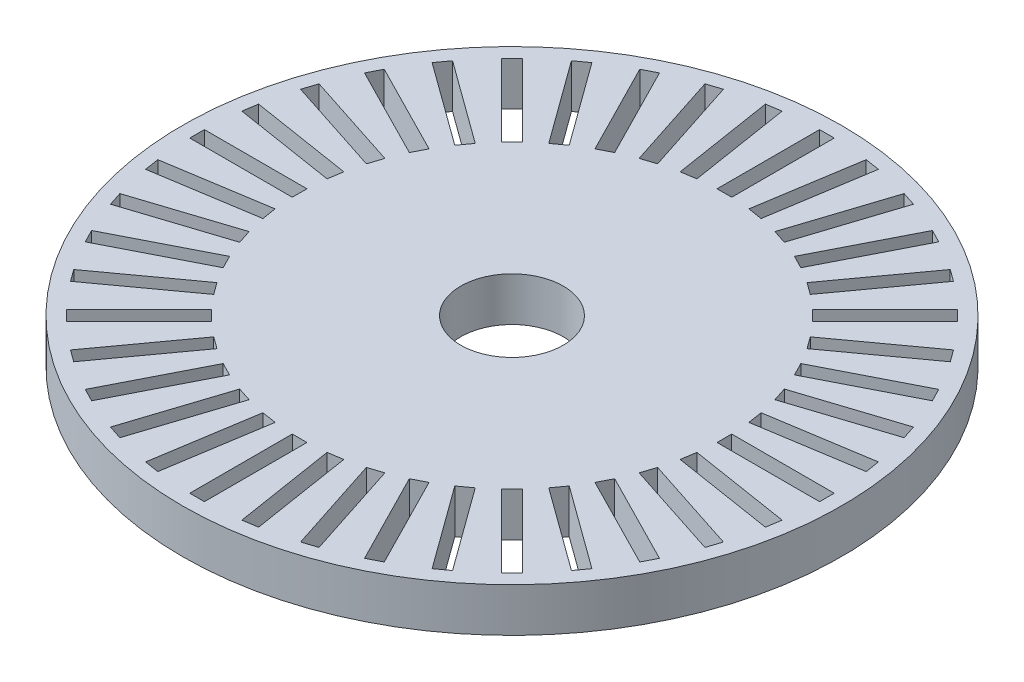
from build123d import *

# Parameters (mm, degrees)
CROQUIS1_R              = 22.5
CROQUIS1_R_2            = 3.5
CROQUIS1_W              = 1
CROQUIS1_H              = 7
CROQUIS1_W_2            = 7
CROQUIS1_H_2            = 1
SALIENTE_EXTRUIR1_DEPTH = 3


with BuildPart() as part:
    # Croquis1 → Saliente-Extruir1 (new body)
    with BuildSketch(Plane(origin=(0, 0, 0), x_dir=(1, 0, 0), z_dir=(0, 1, 0))):
        with Locations(Location((0, 0, 0), (0, 0, 270))):
            Circle(CROQUIS1_R)
        with Locations(Location((0, 0, 0), (0, 0, 270))):
            Circle(CROQUIS1_R_2, mode=Mode.SUBTRACT)
        with Locations((0, 18)):
            Rectangle(CROQUIS1_W, CROQUIS1_H, mode=Mode.SUBTRACT)
        Polygon((2.869496828, 21.313516555), (3.857185169, 21.15708209), (2.762143913, 14.243263706), (1.774455573, 14.399698171), align=None, mode=Mode.SUBTRACT)
        Polygon((6.168337121, 20.602223598), (7.119393637, 20.293206603), (4.956274677, 13.635810989), (4.00521816, 13.944827983), align=None, mode=Mode.SUBTRACT)
        Polygon((9.315292482, 19.38363552), (10.206299006, 18.92964502), (7.028365508, 12.692599351), (6.137358984, 13.146589851), align=None, mode=Mode.SUBTRACT)
        Polygon((12.232874427, 17.687758005), (13.041891421, 17.099972753), (8.927394655, 11.436853792), (8.118377661, 12.024639045), align=None, mode=Mode.SUBTRACT)
        Polygon((14.849242405, 15.556349186), (15.556349186, 14.849242405), (10.606601718, 9.899494937), (9.899494937, 10.606601718), align=None, mode=Mode.SUBTRACT)
        Polygon((17.099972753, 13.041891421), (17.687758005, 12.232874427), (12.024639045, 8.118377661), (11.436853792, 8.927394655), align=None, mode=Mode.SUBTRACT)
        Polygon((18.92964502, 10.206299006), (19.38363552, 9.315292482), (13.146589851, 6.137358984), (12.692599351, 7.028365508), align=None, mode=Mode.SUBTRACT)
        Polygon((20.293206603, 7.119393637), (20.602223598, 6.168337121), (13.944827983, 4.00521816), (13.635810989, 4.956274677), align=None, mode=Mode.SUBTRACT)
        Polygon((21.15708209, 3.857185169), (21.313516555, 2.869496828), (14.399698171, 1.774455573), (14.243263706, 2.762143913), align=None, mode=Mode.SUBTRACT)
        with Locations((18, 0)):
            Rectangle(CROQUIS1_W_2, CROQUIS1_H_2, mode=Mode.SUBTRACT)
        Polygon((21.313516555, -2.869496828), (21.15708209, -3.857185169), (14.243263706, -2.762143913), (14.399698171, -1.774455573), align=None, mode=Mode.SUBTRACT)
        Polygon((20.602223598, -6.168337121), (20.293206603, -7.119393637), (13.635810989, -4.956274677), (13.944827983, -4.00521816), align=None, mode=Mode.SUBTRACT)
        Polygon((19.38363552, -9.315292482), (18.92964502, -10.206299006), (12.692599351, -7.028365508), (13.146589851, -6.137358984), align=None, mode=Mode.SUBTRACT)
        Polygon((17.687758005, -12.232874427), (17.099972753, -13.041891421), (11.436853792, -8.927394655), (12.024639045, -8.118377661), align=None, mode=Mode.SUBTRACT)
        Polygon((15.556349186, -14.849242405), (14.849242405, -15.556349186), (9.899494937, -10.606601718), (10.606601718, -9.899494937), align=None, mode=Mode.SUBTRACT)
        Polygon((13.041891421, -17.099972753), (12.232874427, -17.687758005), (8.118377661, -12.024639045), (8.927394655, -11.436853792), align=None, mode=Mode.SUBTRACT)
        Polygon((10.206299006, -18.92964502), (9.315292482, -19.38363552), (6.137358984, -13.146589851), (7.028365508, -12.692599351), align=None, mode=Mode.SUBTRACT)
        Polygon((7.119393637, -20.293206603), (6.168337121, -20.602223598), (4.00521816, -13.944827983), (4.956274677, -13.635810989), align=None, mode=Mode.SUBTRACT)
        Polygon((3.857185169, -21.15708209), (2.869496828, -21.313516555), (1.774455573, -14.399698171), (2.762143913, -14.243263706), align=None, mode=Mode.SUBTRACT)
        with Locations((0, -18)):
            Rectangle(CROQUIS1_W, CROQUIS1_H, mode=Mode.SUBTRACT)
        Polygon((-2.869496828, -21.313516555), (-3.857185169, -21.15708209), (-2.762143913, -14.243263706), (-1.774455573, -14.399698171), align=None, mode=Mode.SUBTRACT)
        Polygon((-6.168337121, -20.602223598), (-7.119393637, -20.293206603), (-4.956274677, -13.635810989), (-4.00521816, -13.944827983), align=None, mode=Mode.SUBTRACT)
        Polygon((-9.315292482, -19.38363552), (-10.206299006, -18.92964502), (-7.028365508, -12.692599351), (-6.137358984, -13.146589851), align=None, mode=Mode.SUBTRACT)
        Polygon((-12.232874427, -17.687758005), (-13.041891421, -17.099972753), (-8.927394655, -11.436853792), (-8.118377661, -12.024639045), align=None, mode=Mode.SUBTRACT)
        Polygon((-14.849242405, -15.556349186), (-15.556349186, -14.849242405), (-10.606601718, -9.899494937), (-9.899494937, -10.606601718), align=None, mode=Mode.SUBTRACT)
        Polygon((-17.099972753, -13.041891421), (-17.687758005, -12.232874427), (-12.024639045, -8.118377661), (-11.436853792, -8.927394655), align=None, mode=Mode.SUBTRACT)
        Polygon((-18.92964502, -10.206299006), (-19.38363552, -9.315292482), (-13.146589851, -6.137358984), (-12.692599351, -7.028365508), align=None, mode=Mode.SUBTRACT)
        Polygon((-20.293206603, -7.119393637), (-20.602223598, -6.168337121), (-13.944827983, -4.00521816), (-13.635810989, -4.956274677), align=None, mode=Mode.SUBTRACT)
        Polygon((-21.15708209, -3.857185169), (-21.313516555, -2.869496828), (-14.399698171, -1.774455573), (-14.243263706, -2.762143913), align=None, mode=Mode.SUBTRACT)
        with Locations((-18, 0)):
            Rectangle(CROQUIS1_W_2, CROQUIS1_H_2, mode=Mode.SUBTRACT)
        Polygon((-21.313516555, 2.869496828), (-21.15708209, 3.857185169), (-14.243263706, 2.762143913), (-14.399698171, 1.774455573), align=None, mode=Mode.SUBTRACT)
        Polygon((-20.602223598, 6.168337121), (-20.293206603, 7.119393637), (-13.635810989, 4.956274677), (-13.944827983, 4.00521816), align=None, mode=Mode.SUBTRACT)
        Polygon((-19.38363552, 9.315292482), (-18.92964502, 10.206299006), (-12.692599351, 7.028365508), (-13.146589851, 6.137358984), align=None, mode=Mode.SUBTRACT)
        Polygon((-17.687758005, 12.232874427), (-17.099972753, 13.041891421), (-11.436853792, 8.927394655), (-12.024639045, 8.118377661), align=None, mode=Mode.SUBTRACT)
        Polygon((-15.556349186, 14.849242405), (-14.849242405, 15.556349186), (-9.899494937, 10.606601718), (-10.606601718, 9.899494937), align=None, mode=Mode.SUBTRACT)
        Polygon((-13.041891421, 17.099972753), (-12.232874427, 17.687758005), (-8.118377661, 12.024639045), (-8.927394655, 11.436853792), align=None, mode=Mode.SUBTRACT)
        Polygon((-10.206299006, 18.92964502), (-9.315292482, 19.38363552), (-6.137358984, 13.146589851), (-7.028365508, 12.692599351), align=None, mode=Mode.SUBTRACT)
        Polygon((-7.119393637, 20.293206603), (-6.168337121, 20.602223598), (-4.00521816, 13.944827983), (-4.956274677, 13.635810989), align=None, mode=Mode.SUBTRACT)
        Polygon((-3.857185169, 21.15708209), (-2.869496828, 21.313516555), (-1.774455573, 14.399698171), (-2.762143913, 14.243263706), align=None, mode=Mode.SUBTRACT)
    extrude(amount=SALIENTE_EXTRUIR1_DEPTH)


solid = part.part
